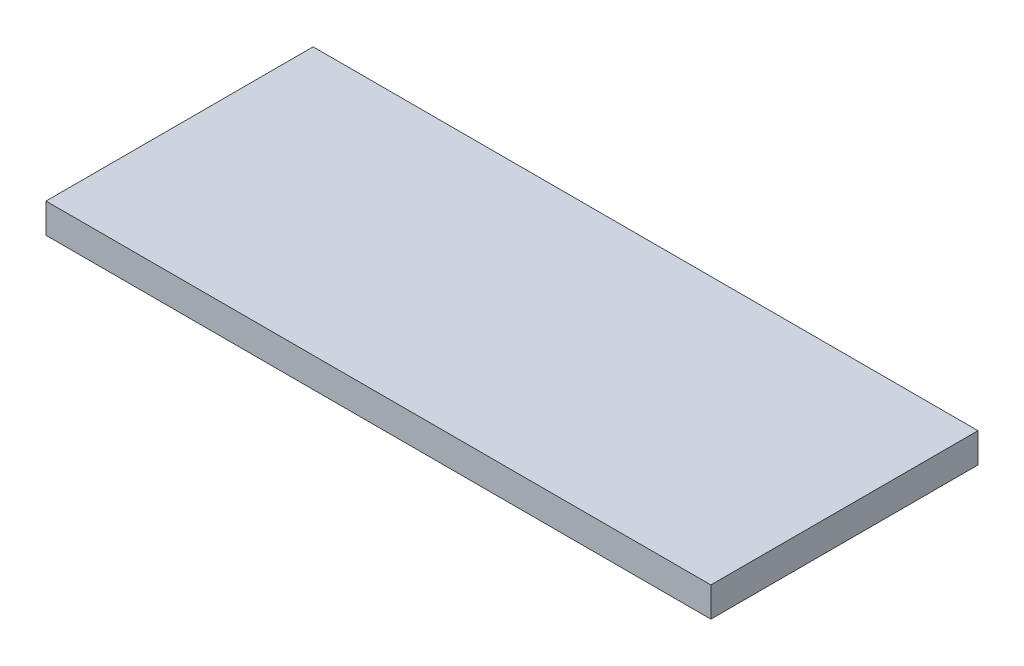
from build123d import *

# Parameters (mm, degrees)
SKETCH_2_W      = 224
SKETCH_2_H      = 90
EXTRUDE_1_DEPTH = 10


with BuildPart() as part:
    # 草图2 → 凸台-拉伸1 (new body)
    with BuildSketch(Plane(origin=(0, 0, 0), x_dir=(1, 0, 0), z_dir=(0, 1, 0))):
        Rectangle(SKETCH_2_W, SKETCH_2_H)
    extrude(amount=EXTRUDE_1_DEPTH)


solid = part.part
